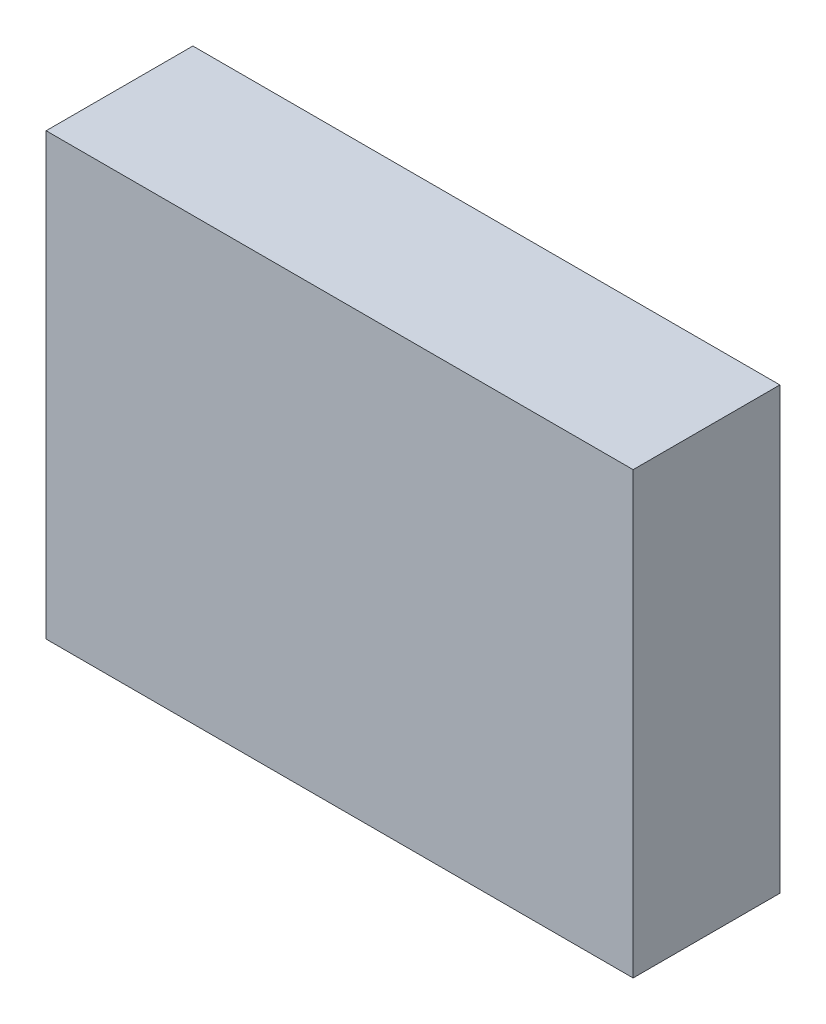
from build123d import *

# Parameters (mm, degrees)
SKETCH1_W           = 40
SKETCH1_H           = 30
BOSS_EXTRUDE1_DEPTH = 10


with BuildPart() as part:
    # Sketch1 → Boss-Extrude1 (new body)
    with BuildSketch(Plane.XY):
        with Locations((20, 15)):
            Rectangle(SKETCH1_W, SKETCH1_H)
    extrude(amount=BOSS_EXTRUDE1_DEPTH)


solid = part.part
